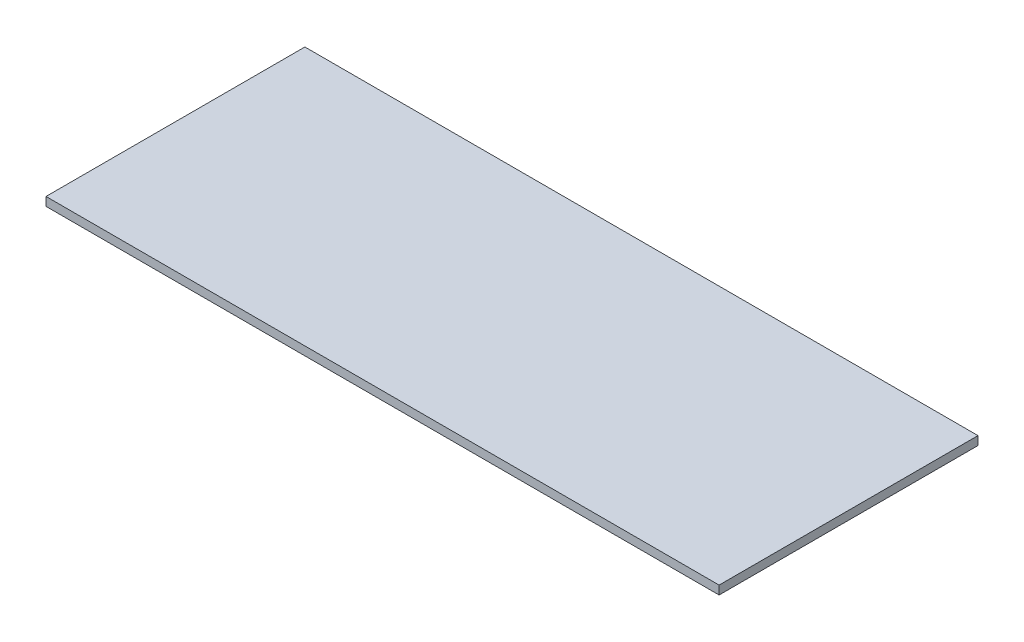
from build123d import *

# Parameters (mm, degrees)
SKETCH2_W           = 1981.2
SKETCH2_H           = 762
BOSS_EXTRUDE1_DEPTH = 25.4


with BuildPart() as part:
    # Sketch2 → Boss-Extrude1 (new body)
    with BuildSketch(Plane(origin=(0, 0, 0), x_dir=(1, 0, 0), z_dir=(0, 1, 0))):
        Rectangle(SKETCH2_W, SKETCH2_H)
    extrude(amount=BOSS_EXTRUDE1_DEPTH)


solid = part.part
